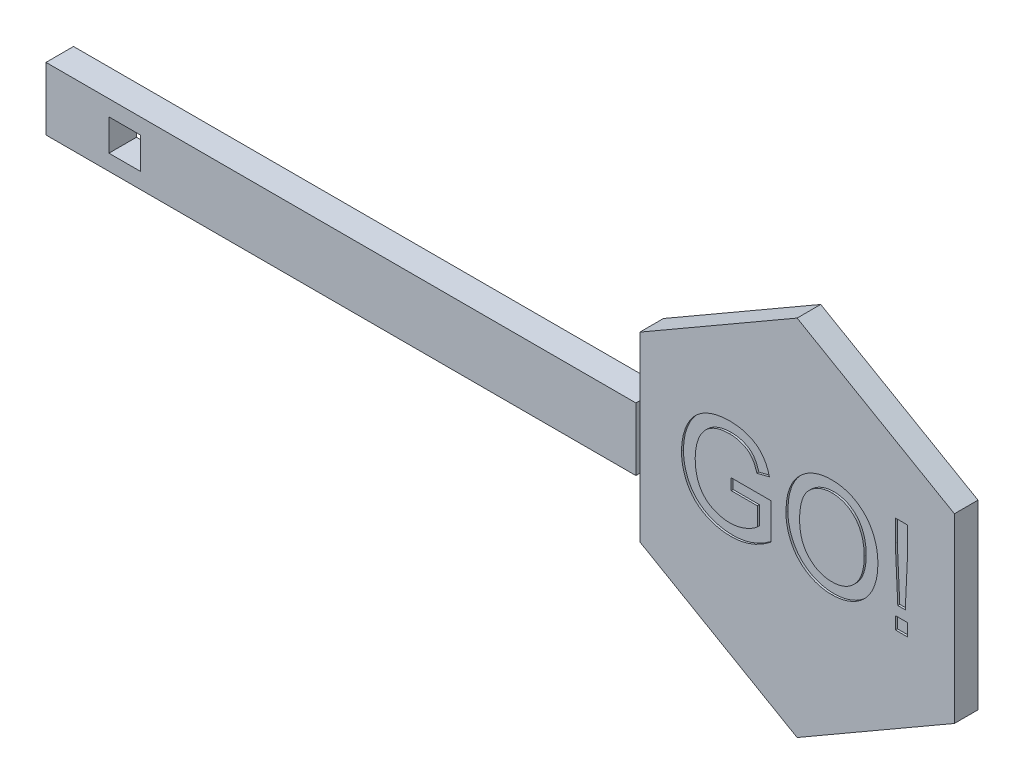
from build123d import *

# Parameters (mm, degrees)
SKETCH1_W        = 75
SKETCH1_H        = 8
ARM_DEPTH        = 3.5
HEX_SIGN_DEPTH   = 3
SKETCH3_W        = 1.580503806
SKETCH3_H        = 1.580503806
GO_TEXT_DEPTH    = 0.25
SKETCH4_W        = 4
SKETCH4_H        = 4
ARM_SQUARE_DEPTH = 108.566646127


with BuildPart() as part:
    # Sketch1 → Arm (new body)
    with BuildSketch(Plane.XY):
        with Locations((27.5, 0)):
            Rectangle(SKETCH1_W, SKETCH1_H)
    extrude(amount=ARM_DEPTH)

    # Sketch2 → Hex Sign (add)
    with BuildSketch(Plane.XY):
        Polygon((85, -23.094010768), (105, -11.547005384), (105, 11.547005384), (85, 23.094010768), (65, 11.547005384), (65, -11.547005384), align=None)
    extrude(amount=HEX_SIGN_DEPTH)

    # Sketch3 → GO Text (cut)
    # profile 1 of 4: a face of its own
    with BuildSketch(Plane.XY.offset(3)):
        with BuildLine():
            Line((76.623329828, -0.100438201), (76.623329828, 1.322015224))
            Line((76.623329828, 1.322015224), (81.680942007, 1.322015224))
            Line((81.680942007, 1.322015224), (81.680942007, -3.239219979))
            add(Edge.make_bspline(
                [(81.680942007, -3.239219979), (81.481393585, -3.391201663), (81.088657528, -3.690320477), (80.472731102, -4.080413806), (79.846702431, -4.411259317), (79.21230164, -4.684394609), (78.567348209, -4.895200573), (77.914626605, -5.046090519), (77.253426021, -5.141662523), (76.808862813, -5.15258294), (76.58628677, -5.158050381)],
                knots=[0, 0, 0, 0, 1.08433114, 2.134098231, 3.14842993, 4.143565882, 5.117308249, 6.078377492, 7.037916032, 8, 8, 8, 8], degree=3))
            add(Edge.make_bspline(
                [(76.58628677, -5.158050381), (76.437206968, -5.155761876), (76.141054764, -5.151215681), (75.702586381, -5.112322768), (75.274356244, -5.054533428), (74.857176613, -4.969557322), (74.449574677, -4.861373413), (74.052335527, -4.727677458), (73.665292659, -4.571664458), (73.290603554, -4.392802456), (72.93390002, -4.187872451), (72.596163573, -3.963182845), (72.281654854, -3.715348733), (71.989889769, -3.446397259), (71.721923261, -3.15472833), (71.47378506, -2.844218466), (71.252131049, -2.509177729), (71.052066743, -2.155768931), (70.875409244, -1.786666424), (70.721163116, -1.405020046), (70.593664087, -1.011745358), (70.487328192, -0.608582171), (70.402764184, -0.195682435), (70.343698845, 0.228247918), (70.308930119, 0.662884657), (70.303869727, 0.956461409), (70.301314603, 1.104695951)],
                knots=[0, 0, 0, 0, 1.072770755, 2.131096365, 3.165876834, 4.181397123, 5.193125461, 6.199217581, 7.195986042, 8.195005739, 9.184865672, 10.154356418, 11.112044544, 12.063776475, 13.007136321, 13.960176652, 14.921449994, 15.895149614, 16.88092309, 17.86448639, 18.855604391, 19.854360534, 20.864074582, 21.88711945, 22.933151623, 24, 24, 24, 24], degree=3))
            add(Edge.make_bspline(
                [(70.301314603, 1.104695951), (70.303876754, 1.252107295), (70.308965087, 1.544860543), (70.344030812, 1.981106689), (70.403312567, 2.409714615), (70.485153403, 2.830929417), (70.58843635, 3.244385726), (70.717104453, 3.650163577), (70.871044964, 4.047891255), (71.045392929, 4.436728266), (71.239573991, 4.811111074), (71.462572236, 5.159075016), (71.697026592, 5.488750332), (71.962280211, 5.785804806), (72.239871843, 6.065575828), (72.543383848, 6.314577568), (72.865166035, 6.540305569), (73.206610115, 6.740333758), (73.565707593, 6.914899652), (73.938173296, 7.068640823), (74.324852558, 7.19621734), (74.723529058, 7.303851255), (75.136411905, 7.383824942), (75.562436869, 7.443984622), (76.002085318, 7.478346049), (76.299763381, 7.483414285), (76.450462224, 7.485980068)],
                knots=[0, 0, 0, 0, 1.059979929, 2.105079288, 3.144800512, 4.169876923, 5.189194625, 6.207600986, 7.228841866, 8.254191695, 9.270945245, 10.257936415, 11.22408152, 12.176290364, 13.118065146, 14.055588944, 14.994904974, 15.942096138, 16.897776019, 17.864011786, 18.837383209, 19.823806203, 20.831455606, 21.859450402, 22.916351634, 24, 24, 24, 24], degree=3))
            add(Edge.make_bspline(
                [(76.450462224, 7.485980068), (76.668010363, 7.480746254), (77.093070734, 7.470520071), (77.715386923, 7.39098602), (78.303950142, 7.254892175), (78.77038161, 7.098534945), (79.120708886, 6.946162603), (79.368339176, 6.823015035), (79.601106954, 6.688539588), (79.821691572, 6.547106313), (80.025167428, 6.389434342), (80.214208203, 6.222937734), (80.389311371, 6.045620222), (80.604889074, 5.792554061), (80.851500757, 5.441020152), (81.098943663, 4.963657423), (81.315673366, 4.431527235), (81.422940678, 4.050454792), (81.478439957, 3.853290851)],
                knots=[0, 0, 0, 0, 1.539867261, 3.008697525, 4.432261777, 5.810773619, 6.484177873, 7.135742803, 7.767512201, 8.386601754, 8.989234153, 9.587908519, 10.168964172, 10.7517707, 11.940093668, 13.199243526, 14.550910222, 16, 16, 16, 16], degree=3))
            Line((81.478439957, 3.853290851), (79.888058002, 3.453225825))
            add(Edge.make_bspline(
                [(79.888058002, 3.453225825), (79.842155584, 3.599528391), (79.754242223, 3.879730414), (79.599392519, 4.271354718), (79.419005651, 4.609519161), (79.226127647, 4.907179494), (78.996342868, 5.163238702), (78.729553697, 5.390124917), (78.417771799, 5.5871681), (78.067862782, 5.755875841), (77.687450223, 5.893639986), (77.282564393, 5.991813278), (76.857327691, 6.052869163), (76.56674069, 6.059924153), (76.41835824, 6.063526643)],
                knots=[0, 0, 0, 0, 1.164883671, 2.23101188, 3.193404931, 4.072828119, 4.918883984, 5.797350418, 6.725503451, 7.712871826, 8.743577122, 9.793233972, 10.87315899, 12, 12, 12, 12], degree=3))
            add(Edge.make_bspline(
                [(76.41835824, 6.063526643), (76.242841841, 6.059102161), (75.903020564, 6.050535821), (75.410571808, 5.989126481), (74.954860524, 5.884366855), (74.537414139, 5.735093221), (74.159985894, 5.551604441), (73.817175645, 5.34411922), (73.514794897, 5.106585225), (73.251694273, 4.842032305), (73.02288477, 4.559024819), (72.818849192, 4.264031124), (72.641413771, 3.954671222), (72.546642618, 3.737348779), (72.499202709, 3.628562966)],
                knots=[0, 0, 0, 0, 1.282088634, 2.482280855, 3.618640035, 4.691464057, 5.71354971, 6.679981643, 7.61357903, 8.515091979, 9.399860987, 10.268958177, 11.133486685, 12, 12, 12, 12], degree=3))
            add(Edge.make_bspline(
                [(72.499202709, 3.628562966), (72.428361215, 3.43722801), (72.285769611, 3.052104021), (72.146471668, 2.445137384), (72.056552973, 1.815343058), (72.045485962, 1.386544758), (72.03986879, 1.168903918)],
                knots=[0, 0, 0, 0, 0.971932623, 1.956331326, 2.96271565, 4, 4, 4, 4], degree=3))
            add(Edge.make_bspline(
                [(72.03986879, 1.168903918), (72.040720059, 1.035484519), (72.042387722, 0.774111639), (72.072277844, 0.390342515), (72.111360134, 0.022197546), (72.174788622, -0.328517888), (72.250199291, -0.662849073), (72.343735045, -0.980978874), (72.45806847, -1.281319413), (72.58577188, -1.566811759), (72.731886551, -1.834371985), (72.894601097, -2.083715144), (73.073311592, -2.314708237), (73.267408617, -2.527606079), (73.47401293, -2.726685259), (73.699594992, -2.904348731), (73.941618131, -3.063176862), (74.281166776, -3.252321855), (74.728872138, -3.443265747), (75.283833962, -3.613625822), (75.857393827, -3.714807011), (76.245100232, -3.72862822), (76.440584075, -3.735596955)],
                knots=[0, 0, 0, 0, 1.070760406, 2.097653971, 3.088708526, 4.041547766, 4.95691435, 5.839291284, 6.700934147, 7.534993757, 8.348268852, 9.145600082, 9.922850605, 10.690119832, 11.456705726, 12.223547942, 12.991528328, 13.778467112, 15.341275849, 16.888285822, 18.431055468, 20, 20, 20, 20], degree=3))
            add(Edge.make_bspline(
                [(76.440584075, -3.735596955), (76.612066115, -3.729953415), (76.954239838, -3.718692346), (77.463665217, -3.640549235), (77.965081835, -3.507859562), (78.449872547, -3.328713696), (78.903362534, -3.123517015), (79.304778893, -2.903649039), (79.653354838, -2.68425682), (79.849428362, -2.516265793), (79.942387821, -2.436620389)],
                knots=[0, 0, 0, 0, 1.08078364, 2.156585965, 3.240205791, 4.344938036, 5.41078367, 6.374425311, 7.229306744, 8, 8, 8, 8], degree=3))
            Line((79.942387821, -2.436620389), (79.942387821, -0.100438201))
            Line((79.942387821, -0.100438201), (76.623329828, -0.100438201))
        make_face()
    # profile 2 of 4: a face of its own
    with BuildSketch(Plane.XY.offset(3)):
        with BuildLine():
            add(Edge.make_bspline(
                [(83.577546575, 1.000975389), (83.581831288, 1.248139753), (83.590179836, 1.729726983), (83.668184818, 2.430980044), (83.794844887, 3.090767445), (83.975916663, 3.709037784), (84.205425659, 4.286759895), (84.484437687, 4.825241942), (84.821345244, 5.318388695), (85.202473543, 5.770894591), (85.628176348, 6.17094297), (86.08142884, 6.526243246), (86.567890719, 6.822605682), (87.083067453, 7.067303351), (87.629147803, 7.255175135), (88.204598544, 7.386702479), (88.808804233, 7.471550398), (89.221792962, 7.481100314), (89.432819269, 7.485980068)],
                knots=[0, 0, 0, 0, 1.203621547, 2.345195544, 3.432004029, 4.472479546, 5.478447225, 6.455936844, 7.420185704, 8.381829745, 9.332027588, 10.260832629, 11.182364398, 12.100723901, 13.034044877, 13.989196293, 14.972532542, 16, 16, 16, 16], degree=3))
            add(Edge.make_bspline(
                [(89.432819269, 7.485980068), (89.572005619, 7.483549612), (89.848404536, 7.478723167), (90.257035666, 7.442000363), (90.655166413, 7.376456519), (91.042404718, 7.288620419), (91.419804646, 7.173383275), (91.787591574, 7.037349334), (92.142545937, 6.868784125), (92.487029153, 6.6800586), (92.816974852, 6.46896094), (93.127056993, 6.235761784), (93.416532833, 5.982224805), (93.689290817, 5.712517462), (93.936229394, 5.417537508), (94.167550226, 5.106270537), (94.376606172, 4.773197282), (94.564139008, 4.421046714), (94.731812422, 4.055257734), (94.875121732, 3.674314296), (94.998178821, 3.282786083), (95.101187987, 2.878355667), (95.175099843, 2.461161309), (95.233956653, 2.033000658), (95.264934618, 1.592474343), (95.270471247, 1.294890966), (95.27327474, 1.144208546)],
                knots=[0, 0, 0, 0, 1.034375294, 2.054082248, 3.045783978, 4.031219655, 5.002789406, 5.976610191, 6.94273282, 7.920236376, 8.894345378, 9.851183672, 10.800797181, 11.752517031, 12.698794154, 13.65688337, 14.632873302, 15.61821402, 16.620222298, 17.621258913, 18.640965868, 19.669244166, 20.720417492, 21.788124603, 22.880008887, 24, 24, 24, 24], degree=3))
            add(Edge.make_bspline(
                [(95.27327474, 1.144208546), (95.27070613, 0.99104137), (95.2656314, 0.688433203), (95.231293696, 0.241388354), (95.170916078, -0.192822764), (95.090835447, -0.615494891), (94.983529846, -1.025748111), (94.85601363, -1.424758645), (94.701775562, -1.810149907), (94.527580788, -2.182850769), (94.330479476, -2.537735302), (94.113063354, -2.872321985), (93.875178398, -3.183481025), (93.620438052, -3.475029547), (93.342893454, -3.74175412), (93.045962186, -3.986148814), (92.730785949, -4.210518549), (92.396305909, -4.40878669), (92.048524768, -4.582575798), (91.694324566, -4.736758047), (91.333442194, -4.868250804), (90.964644269, -4.974812614), (90.588936833, -5.055338388), (90.207377173, -5.115636937), (89.818714483, -5.150357049), (89.557185616, -5.155472759), (89.425410657, -5.158050381)],
                knots=[0, 0, 0, 0, 1.141429366, 2.255090526, 3.338676798, 4.407031443, 5.458968682, 6.496860253, 7.526652771, 8.550250826, 9.560787671, 10.54935636, 11.521089193, 12.477323897, 13.431786008, 14.386110112, 15.340986122, 16.312041, 17.28047646, 18.236612773, 19.189437236, 20.140779471, 21.09494583, 22.051062463, 23.018000708, 24, 24, 24, 24], degree=3))
            add(Edge.make_bspline(
                [(89.425410657, -5.158050381), (89.283723309, -5.155954099), (89.003076157, -5.151801889), (88.588272107, -5.110355762), (88.18378773, -5.04712825), (87.790798934, -4.955846826), (87.409842723, -4.836763758), (87.040468337, -4.692629381), (86.68137665, -4.525370005), (86.337023393, -4.330196448), (86.008580604, -4.113184432), (85.699231671, -3.875412714), (85.409147652, -3.619072571), (85.142983207, -3.339927008), (84.892118108, -3.048095159), (84.666583069, -2.732729815), (84.459012467, -2.400983132), (84.275548657, -2.049657215), (84.109816561, -1.689192139), (83.97018369, -1.319472601), (83.847473458, -0.945947284), (83.749747179, -0.566313934), (83.671871228, -0.181448279), (83.619505294, 0.208009279), (83.581686218, 0.602638769), (83.5789334, 0.867528327), (83.577546575, 1.000975389)],
                knots=[0, 0, 0, 0, 1.072727997, 2.12480551, 3.153819198, 4.171534612, 5.177148798, 6.173931848, 7.17235114, 8.174500385, 9.168706755, 10.151274001, 11.127173509, 12.097141049, 13.070188938, 14.039134204, 15.03036519, 16.031505612, 17.038625933, 18.033164522, 19.022845559, 20.014762458, 21.000193215, 21.994692725, 22.989758729, 24, 24, 24, 24], degree=3))
        make_face()
        with BuildLine():
            add(Edge.make_bspline(
                [(85.316100761, 0.981219091), (85.318765013, 0.803238448), (85.323960116, 0.456188754), (85.383394909, -0.049791244), (85.473577713, -0.527209139), (85.59788519, -0.977405159), (85.76498488, -1.395926931), (85.964774196, -1.786796042), (86.203980089, -2.147414218), (86.477324966, -2.476772668), (86.777972994, -2.772643619), (87.099245924, -3.031071157), (87.441215975, -3.247485939), (87.800091802, -3.426182542), (88.178451042, -3.565671534), (88.575160505, -3.66361719), (88.99051167, -3.724874247), (89.273729943, -3.731978189), (89.418002045, -3.735596955)],
                knots=[0, 0, 0, 0, 1.215430442, 2.370003584, 3.475209778, 4.53279855, 5.55522989, 6.548792651, 7.526809858, 8.505409025, 9.467826767, 10.404123909, 11.316848639, 12.227335424, 13.138360512, 14.065900994, 15.014765094, 16, 16, 16, 16], degree=3))
            add(Edge.make_bspline(
                [(89.418002045, -3.735596955), (89.564719566, -3.731924665), (89.851992058, -3.724734332), (90.273605206, -3.664546629), (90.674184893, -3.562079631), (91.05770158, -3.425672844), (91.417221656, -3.241274121), (91.761153268, -3.025344227), (92.080120797, -2.76148408), (92.381953993, -2.46508985), (92.652678037, -2.128183371), (92.892888634, -1.759063722), (93.088018814, -1.352195048), (93.256487389, -0.916540109), (93.379849789, -0.44386486), (93.471022162, 0.060457331), (93.525964564, 0.59804871), (93.531750282, 0.967095217), (93.534720553, 1.156556232)],
                knots=[0, 0, 0, 0, 0.976878588, 1.912725521, 2.8289017, 3.727303729, 4.617335839, 5.514666588, 6.426584173, 7.368641557, 8.327632997, 9.299405846, 10.294892156, 11.327373912, 12.405931897, 13.542618837, 14.738430195, 16, 16, 16, 16], degree=3))
            add(Edge.make_bspline(
                [(93.534720553, 1.156556232), (93.53367086, 1.278443117), (93.531611743, 1.517541077), (93.504342135, 1.869974206), (93.469167838, 2.211444647), (93.415614425, 2.54151178), (93.341811027, 2.858808722), (93.260049396, 3.165751063), (93.157809334, 3.459693741), (93.041803736, 3.741789487), (92.911995436, 4.010590076), (92.765588938, 4.263829411), (92.604285786, 4.500522953), (92.432438126, 4.725158174), (92.240530007, 4.929040768), (92.03780192, 5.120782833), (91.819648901, 5.296422935), (91.58824804, 5.456006954), (91.346882055, 5.599657721), (91.096048523, 5.722604139), (90.839743579, 5.830597121), (90.573677039, 5.913378274), (90.30152277, 5.980142489), (90.02218058, 6.030856128), (89.734613625, 6.057118011), (89.540701583, 6.061375092), (89.442697417, 6.063526643)],
                knots=[0, 0, 0, 0, 1.220438779, 2.394059227, 3.538503547, 4.658058814, 5.74010225, 6.800155734, 7.837851593, 8.854470756, 9.853724944, 10.825214244, 11.781044712, 12.72106398, 13.654479919, 14.581868691, 15.514082315, 16.456304431, 17.39516604, 18.324312202, 19.252140633, 20.177768678, 21.111585046, 22.057694709, 23.018348693, 24, 24, 24, 24], degree=3))
            add(Edge.make_bspline(
                [(89.442697417, 6.063526643), (89.304181899, 6.060775779), (89.030875345, 6.055348019), (88.628535563, 5.995010036), (88.24063639, 5.904856845), (87.866575847, 5.77881788), (87.509553217, 5.611922482), (87.167718797, 5.407248117), (86.838038304, 5.170367745), (86.52571033, 4.895509829), (86.234552343, 4.57976518), (85.988407475, 4.207511913), (85.780949855, 3.787636496), (85.607726564, 3.321203217), (85.475648906, 2.804599857), (85.384366723, 2.240049603), (85.326733016, 1.626957559), (85.319735451, 1.201968021), (85.316100761, 0.981219091)],
                knots=[0, 0, 0, 0, 0.895090134, 1.766112571, 2.624765742, 3.468151641, 4.313618154, 5.168136083, 6.041303099, 6.935189387, 7.854749729, 8.809996334, 9.809869957, 10.877771942, 12.021723904, 13.25217762, 14.572720513, 16, 16, 16, 16], degree=3))
        make_face(mode=Mode.SUBTRACT)
    # profile 3 of 4: a face of its own
    with BuildSketch(Plane.XY.offset(3)):
        Polygon((97.802080829, -2.155093149), (97.485980068, 4.53241358), (97.485980068, 7.327929688), (99.066483874, 7.327929688), (99.066483874, 4.53241358), (98.750383113, -2.155093149), align=None)
    # profile 4 of 4: a face of its own
    with BuildSketch(Plane.XY.offset(3)):
        with Locations((98.276231971, -4.209748097)):
            Rectangle(SKETCH3_W, SKETCH3_H)
    extrude(amount=-GO_TEXT_DEPTH, mode=Mode.SUBTRACT)

    # Sketch4 → Arm Square (cut, through all)
    with BuildSketch(Plane.XY.offset(3.5)):
        Rectangle(SKETCH4_W, SKETCH4_H)
    extrude(amount=-ARM_SQUARE_DEPTH, mode=Mode.SUBTRACT)


solid = part.part
